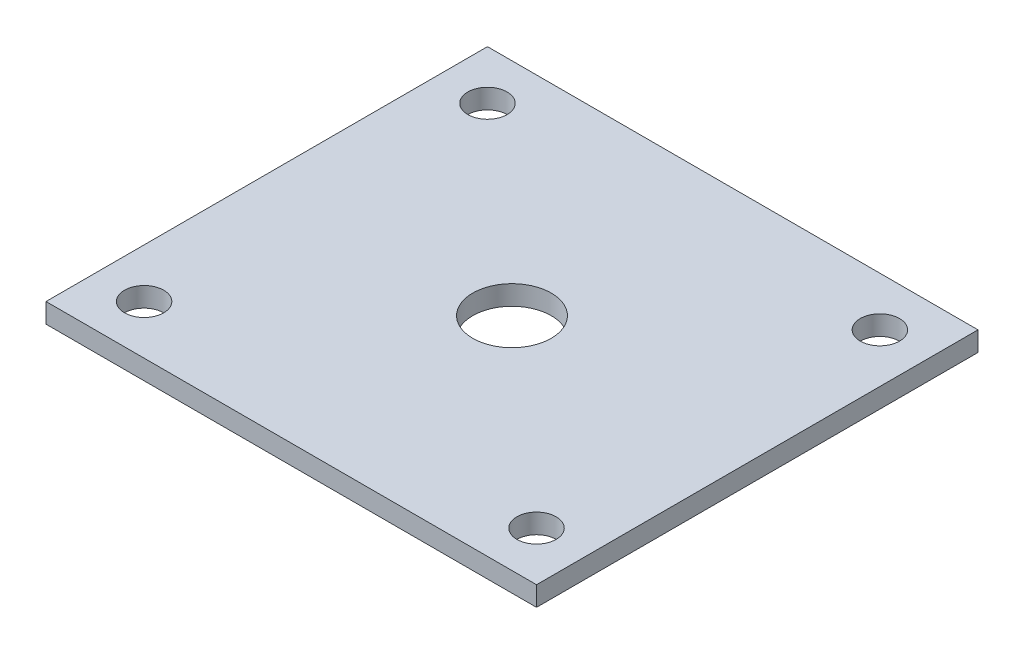
from build123d import *

# Parameters (mm, degrees)
SKETCH1_W      = 100
SKETCH1_H      = 90
SKETCH1_R      = 8
SKETCH1_R_2    = 4
EXTRUDE1_DEPTH = 4


with BuildPart() as part:
    # Sketch1 → Extrude1 (new body)
    with BuildSketch(Plane(origin=(0, 0, 0), x_dir=(1, 0, 0), z_dir=(0, 1, 0))):
        with Locations((50, 45)):
            Rectangle(SKETCH1_W, SKETCH1_H)
        with Locations(Location((50, 45, 0), (0, 0, 270))):
            Circle(SKETCH1_R, mode=Mode.SUBTRACT)
        with Locations(Location((10, 80, 0), (0, 0, 270))):
            Circle(SKETCH1_R_2, mode=Mode.SUBTRACT)
        with Locations(Location((10, 10, 0), (0, 0, 270))):
            Circle(SKETCH1_R_2, mode=Mode.SUBTRACT)
        with Locations(Location((90, 10, 0), (0, 0, 270))):
            Circle(SKETCH1_R_2, mode=Mode.SUBTRACT)
        with Locations(Location((90, 80, 0), (0, 0, 270))):
            Circle(SKETCH1_R_2, mode=Mode.SUBTRACT)
    extrude(amount=EXTRUDE1_DEPTH)


solid = part.part
